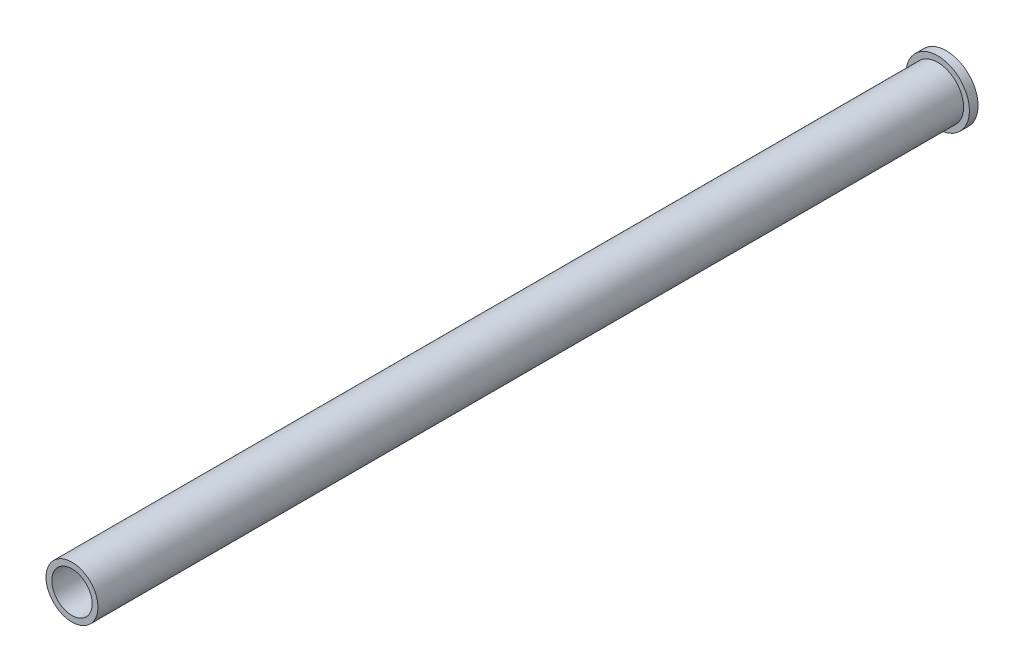
from build123d import *

# Parameters (mm, degrees)
SKETCH1_R           = 2.794
BOSS_EXTRUDE1_DEPTH = 0.762
SKETCH2_R           = 2.286
BOSS_EXTRUDE2_DEPTH = 76.2
SKETCH3_R           = 1.778
CUT_EXTRUDE1_DEPTH  = 12.7


with BuildPart() as part:
    # Sketch1 → Boss-Extrude1 (new body)
    with BuildSketch(Plane.XY):
        with Locations(Location((-8.454430228, 1.683721274, 0), (0, 0, 180))):
            Circle(SKETCH1_R)
    extrude(amount=BOSS_EXTRUDE1_DEPTH)

    # Sketch2 → Boss-Extrude2 (add)
    with BuildSketch(Plane.XY.offset(0.762)):
        with Locations(Location((-8.454430228, 1.683721274, 0), (0, 0, 180))):
            Circle(SKETCH2_R)
    extrude(amount=BOSS_EXTRUDE2_DEPTH)

    # Sketch3 → Cut-Extrude1 (cut)
    with BuildSketch(Plane.XY.offset(76.962)):
        with Locations((-8.454430228, 1.683721274)):
            Circle(SKETCH3_R)
    extrude(amount=-CUT_EXTRUDE1_DEPTH, mode=Mode.SUBTRACT)


solid = part.part
